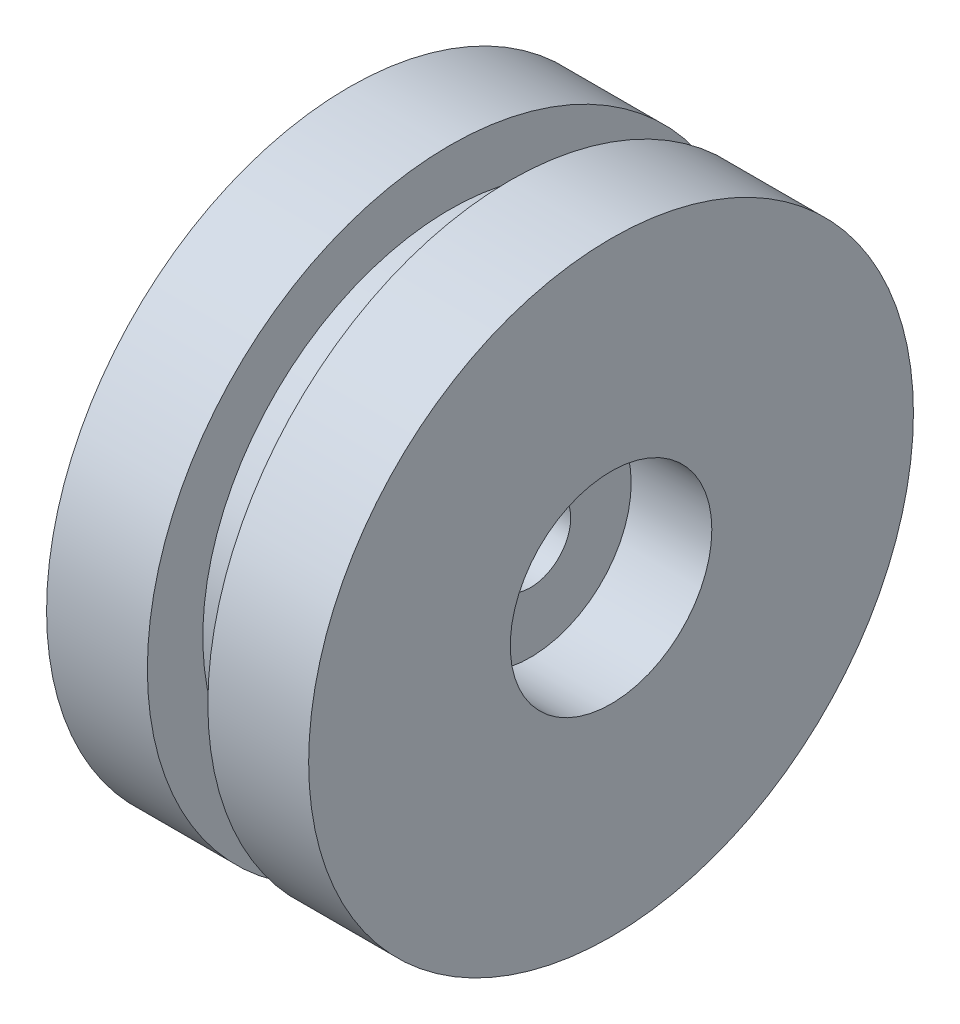
from build123d import *

# Parameters (mm, degrees)
SKETCH2_R          = 5
CUT_EXTRUDE1_DEPTH = 4
CUT_EXTRUDE2_START = 4
SKETCH3_R          = 2
CUT_EXTRUDE2_DEPTH = 6.5
CUT_EXTRUDE4_START = -9
SKETCH4_R          = 2.5
CUT_EXTRUDE4_DEPTH = 6.5


with BuildPart() as part:
    # Sketch1 → Revolve1 (revolve)
    with BuildSketch(Plane.XY, mode=Mode.PRIVATE) as revolve1_sk:
        Polygon((-1.5, 15), (-1.5, 12.25), (1.5, 12.25), (1.5, 15), (6.5, 15), (6.5, 0), (-6.5, 0), (-6.5, 15), align=None)
    revolve(revolve1_sk.sketch.rotate(Axis((6.5, 0, 0), (-1, 0, 0)), 90), axis=Axis((6.5, 0, 0), (-1, 0, 0)))

    # Sketch2 → Cut-Extrude1 (cut)
    with BuildSketch(Plane(origin=(6.5, 0, 0), x_dir=(0, 0, -1), z_dir=(1, 0, 0))):
        Circle(SKETCH2_R)
    extrude(amount=-CUT_EXTRUDE1_DEPTH, mode=Mode.SUBTRACT)

    # Sketch3 → Cut-Extrude2 (cut)
    with BuildSketch(Plane(origin=(2.5, 0, 0), x_dir=(0, 0, -1), z_dir=(1, 0, 0)).offset(CUT_EXTRUDE2_START)):
        Circle(SKETCH3_R)
    extrude(amount=-CUT_EXTRUDE2_DEPTH, mode=Mode.SUBTRACT)

    # Sketch4 → Cut-Extrude4 (cut)
    with BuildSketch(Plane(origin=(2.5, 0, 0), x_dir=(0, 0, -1), z_dir=(1, 0, 0)).offset(CUT_EXTRUDE4_START)):
        with Locations(Location((0, 0, 0), (0, 0, 180))):
            Circle(SKETCH4_R)
    extrude(amount=CUT_EXTRUDE4_DEPTH, mode=Mode.SUBTRACT)


solid = part.part
